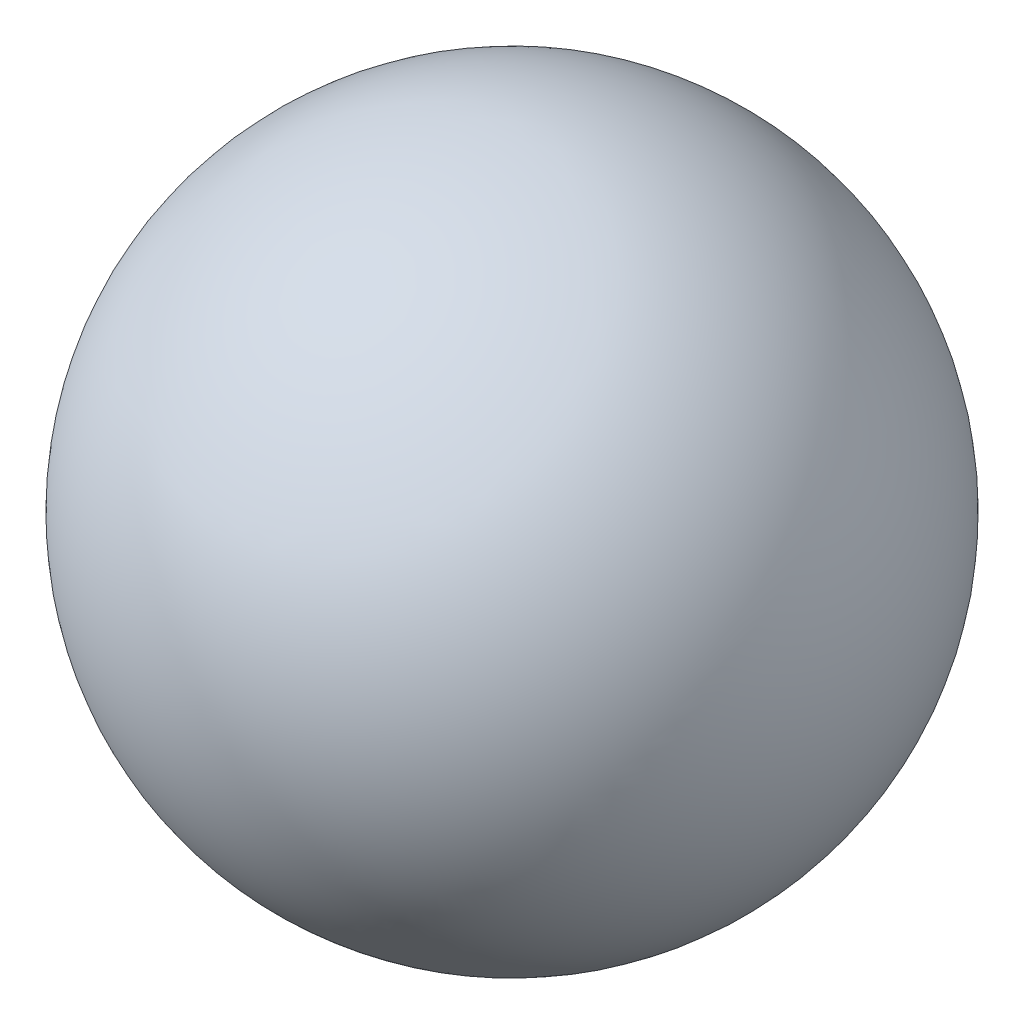
from build123d import *


with BuildPart() as part:
    # Sketch1 → Revolve-Thin1 (revolve)
    with BuildSketch(Plane(origin=(0, 0, 0), x_dir=(1, 0, 0), z_dir=(0, 1, 0))):
        with BuildLine():
            ThreePointArc((-6.841003611, 10.700031289), (10.700031289, 6.841003611), (6.841003611, -10.700031289))
            Line((6.841003611, -10.700031289), (6.30234191, -9.857509141))
            ThreePointArc((6.30234191, -9.857509141), (9.857509141, 6.30234191), (-6.30234191, 9.857509141))
            Line((-6.30234191, 9.857509141), (-6.841003611, 10.700031289))
        make_face()
    revolve(axis=Axis((0, 0, 0), (-0.5386617016680816, 0, -0.8425221487628957)))


solid = part.part
